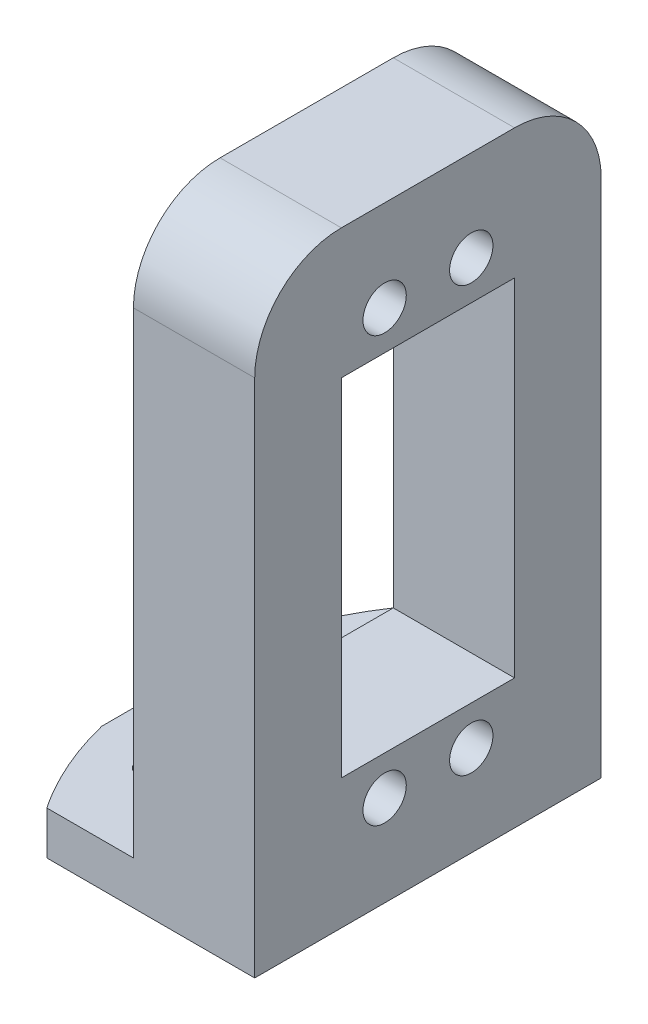
from build123d import *

# Parameters (mm, degrees)
SKETCH1_W           = 40
SKETCH1_H           = 70
BOSS_EXTRUDE2_DEPTH = 9
SKETCH3_W           = 20
SKETCH3_H           = 40
CUT_EXTRUDE1_DEPTH  = 42.303752856
SKETCH4_R           = 1.5
CUT_EXTRUDE2_DEPTH  = 42.303752856
SKETCH6_W           = 40
SKETCH6_H           = 5
BOSS_EXTRUDE3_DEPTH = 15
CUT_EXTRUDE3_DEPTH  = 47.914816423
BOSS_EXTRUDE4_DEPTH = 40
SKETCH9_W           = 40
SKETCH9_H           = 5
BOSS_EXTRUDE5_DEPTH = 5
SKETCH10_R          = 1.5
CUT_EXTRUDE4_DEPTH  = 71.887234394
CUT_EXTRUDE5_DEPTH  = 71.887234394
SKETCH12_R          = 1.5
SKETCH12_W          = 20
SKETCH12_H          = 40
BOSS_EXTRUDE6_DEPTH = 3
BOSS_EXTRUDE7_DEPTH = 40
SKETCH14_R          = 1.5
SKETCH14_W          = 20
SKETCH14_H          = 40
BOSS_EXTRUDE8_DEPTH = 2
BOSS_EXTRUDE9_DEPTH = 40
SKETCH17_R          = 2.5
CUT_EXTRUDE6_DEPTH  = 5


with BuildPart() as part:
    # Sketch1 → Boss-Extrude2 (new body)
    with BuildSketch(Plane(origin=(0, 0, 0), x_dir=(0, 0, -1), z_dir=(1, 0, 0))):
        Rectangle(SKETCH1_W, SKETCH1_H)
    extrude(amount=BOSS_EXTRUDE2_DEPTH)

    # Sketch3 → Cut-Extrude1 (cut, through all)
    with BuildSketch(Plane.ZY):
        Rectangle(SKETCH3_W, SKETCH3_H)
    extrude(amount=-CUT_EXTRUDE1_DEPTH, mode=Mode.SUBTRACT)

    # Sketch4 → Cut-Extrude2 (cut, through all)
    with BuildSketch(Plane(origin=(9, 0, 0), x_dir=(0, 0, -1), z_dir=(1, 0, 0))):
        with Locations((-5, -24.5)):
            Circle(SKETCH4_R)
        with Locations((5, -24.5)):
            Circle(SKETCH4_R)
        with Locations((-5, 24.5)):
            Circle(SKETCH4_R)
        with Locations((5, 24.5)):
            Circle(SKETCH4_R)
    extrude(amount=-CUT_EXTRUDE2_DEPTH, mode=Mode.SUBTRACT)

    # Sketch6 → Boss-Extrude3 (add)
    with BuildSketch(Plane.ZY):
        with Locations((0, -32.5)):
            Rectangle(SKETCH6_W, SKETCH6_H)
    extrude(amount=BOSS_EXTRUDE3_DEPTH)

    # Sketch7 → Cut-Extrude3 (cut, through all)
    with BuildSketch(Plane(origin=(9, 0, 0), x_dir=(0, 0, -1), z_dir=(1, 0, 0))):
        with BuildLine():
            Line((-20, 25), (-20, 35))
            Line((-20, 35), (-10, 35))
            ThreePointArc((-10, 35), (-17.071067812, 32.071067812), (-20, 25))
        make_face()
        with BuildLine():
            Line((10, 35), (20, 35))
            Line((20, 35), (20, 25))
            ThreePointArc((20, 25), (17.071067812, 32.071067812), (10, 35))
        make_face()
    extrude(amount=-CUT_EXTRUDE3_DEPTH, mode=Mode.SUBTRACT)

    # Sketch8 → Boss-Extrude4 (add)
    with BuildSketch(Plane(origin=(0, 0, -20), x_dir=(-1, 0, 0), z_dir=(0, 0, -1))):
        Polygon((0, -27), (5, -30), (0, -30), align=None)
    extrude(amount=-BOSS_EXTRUDE4_DEPTH)

    # Sketch9 → Boss-Extrude5 (add)
    with BuildSketch(Plane.ZY.offset(15)):
        with Locations((0, -32.5)):
            Rectangle(SKETCH9_W, SKETCH9_H)
    extrude(amount=BOSS_EXTRUDE5_DEPTH)

    # Sketch10 → Cut-Extrude4 (cut, through all)
    with BuildSketch(Plane(origin=(0, -30, 0), x_dir=(1, 0, 0), z_dir=(0, 1, 0))):
        with Locations(Location((-13, 10, 0), (0, 0, 270))):
            Circle(SKETCH10_R)
        with Locations(Location((-13, -10, 0), (0, 0, 270))):
            Circle(SKETCH10_R)
    extrude(amount=-CUT_EXTRUDE4_DEPTH, mode=Mode.SUBTRACT)

    # Sketch11 → Cut-Extrude5 (cut, through all)
    with BuildSketch(Plane(origin=(0, -30, 0), x_dir=(1, 0, 0), z_dir=(0, 1, 0))):
        with BuildLine():
            add(Edge.make_bspline(
                [(-15, 20), (-17.354348957, 16.495802807), (-19.021015624, 12.650080232), (-20, 8.662193644)],
                knots=[0, 0, 0, 0, 0.292090214, 0.292090214, 0.292090214, 0.292090214], degree=3))
            Line((-15, 20), (-20, 20))
            Line((-20, 20), (-20, 8.662193644))
        make_face()
        with BuildLine():
            add(Edge.make_bspline(
                [(-20, -8.658433055), (-19.021015624, -12.647055954), (-17.354348957, -16.494032059), (-15, -20)],
                knots=[0.707909786, 0.707909786, 0.707909786, 0.707909786, 1, 1, 1, 1], degree=3))
            Line((-20, -8.658433055), (-20, -20))
            Line((-20, -20), (-15, -20))
        make_face()
    extrude(amount=-CUT_EXTRUDE5_DEPTH, mode=Mode.SUBTRACT)

    # Sketch12 → Boss-Extrude6 (add)
    with BuildSketch(Plane.ZY):
        with BuildLine():
            ThreePointArc((-10, 35), (-17.071067812, 32.071067812), (-20, 25))
            Line((-20, 25), (-20, -27))
            Line((-20, -27), (20, -27))
            Line((20, -27), (20, 25))
            ThreePointArc((20, 25), (17.071067812, 32.071067812), (10, 35))
            Line((10, 35), (-10, 35))
        make_face()
        with Locations(Location((-5, 24.5, 0), (0, 0, 180))):
            Circle(SKETCH12_R, mode=Mode.SUBTRACT)
        with Locations(Location((-5, -24.5, 0), (0, 0, 180))):
            Circle(SKETCH12_R, mode=Mode.SUBTRACT)
        with Locations(Location((5, 24.5, 0), (0, 0, 180))):
            Circle(SKETCH12_R, mode=Mode.SUBTRACT)
        with Locations(Location((5, -24.5, 0), (0, 0, 180))):
            Circle(SKETCH12_R, mode=Mode.SUBTRACT)
        Rectangle(SKETCH12_W, SKETCH12_H, mode=Mode.SUBTRACT)
    extrude(amount=BOSS_EXTRUDE6_DEPTH)

    # Sketch13 → Boss-Extrude7 (add)
    with BuildSketch(Plane(origin=(0, 0, -20), x_dir=(-1, 0, 0), z_dir=(0, 0, -1))):
        Polygon((3, -27), (5, -30), (0, -27), align=None)
    extrude(amount=-BOSS_EXTRUDE7_DEPTH)

    # Sketch14 → Boss-Extrude8 (add)
    with BuildSketch(Plane.ZY.offset(3)):
        with BuildLine():
            Line((-20, -27), (20, -27))
            Line((20, -27), (20, 25))
            ThreePointArc((20, 25), (17.071067812, 32.071067812), (10, 35))
            Line((10, 35), (-10, 35))
            ThreePointArc((-10, 35), (-17.071067812, 32.071067812), (-20, 25))
            Line((-20, 25), (-20, -27))
        make_face()
        with Locations(Location((-5, 24.5, 0), (0, 0, 180))):
            Circle(SKETCH14_R, mode=Mode.SUBTRACT)
        with Locations(Location((5, 24.5, 0), (0, 0, 180))):
            Circle(SKETCH14_R, mode=Mode.SUBTRACT)
        with Locations(Location((-5, -24.5, 0), (0, 0, 180))):
            Circle(SKETCH14_R, mode=Mode.SUBTRACT)
        with Locations(Location((5, -24.5, 0), (0, 0, 180))):
            Circle(SKETCH14_R, mode=Mode.SUBTRACT)
        Rectangle(SKETCH14_W, SKETCH14_H, mode=Mode.SUBTRACT)
    extrude(amount=BOSS_EXTRUDE8_DEPTH)

    # Sketch16 → Boss-Extrude9 (add)
    with BuildSketch(Plane(origin=(0, 0, -20), x_dir=(-1, 0, 0), z_dir=(0, 0, -1))):
        Polygon((5, -27), (3, -27), (5, -30), align=None)
    extrude(amount=-BOSS_EXTRUDE9_DEPTH)

    # Sketch17 → Cut-Extrude6 (cut)
    with BuildSketch(Plane(origin=(9, 0, 0), x_dir=(0, 0, -1), z_dir=(1, 0, 0))):
        with Locations((-5, 24.5)):
            Circle(SKETCH17_R)
        with Locations((5, 24.5)):
            Circle(SKETCH17_R)
        with Locations((-5, -24.5)):
            Circle(SKETCH17_R)
        with Locations((5, -24.5)):
            Circle(SKETCH17_R)
    extrude(amount=-CUT_EXTRUDE6_DEPTH, mode=Mode.SUBTRACT)


solid = part.part
